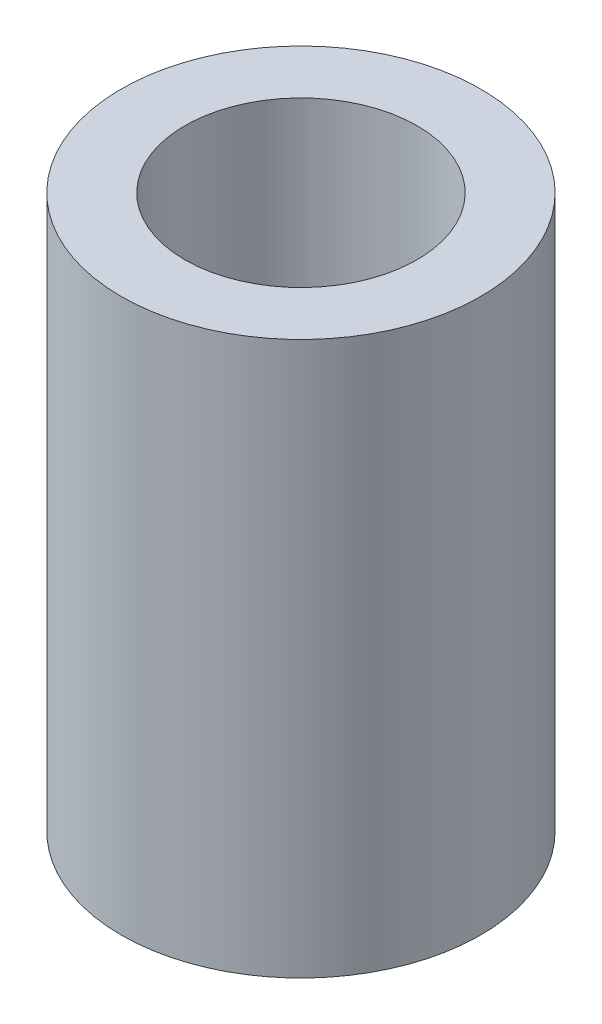
from build123d import *

# Parameters (mm, degrees)
SKETCH1_R           = 3.25
SKETCH1_R_2         = 2.1
BOSS_EXTRUDE1_DEPTH = 10


with BuildPart() as part:
    # Sketch1 → Boss-Extrude1 (new body)
    with BuildSketch(Plane(origin=(0, 0, 0), x_dir=(1, 0, 0), z_dir=(0, 1, 0))):
        with Locations(Location((0, 0, 0), (0, 0, 270))):
            Circle(SKETCH1_R)
        with Locations(Location((0, 0, 0), (0, 0, 270))):
            Circle(SKETCH1_R_2, mode=Mode.SUBTRACT)
    extrude(amount=BOSS_EXTRUDE1_DEPTH)


solid = part.part
